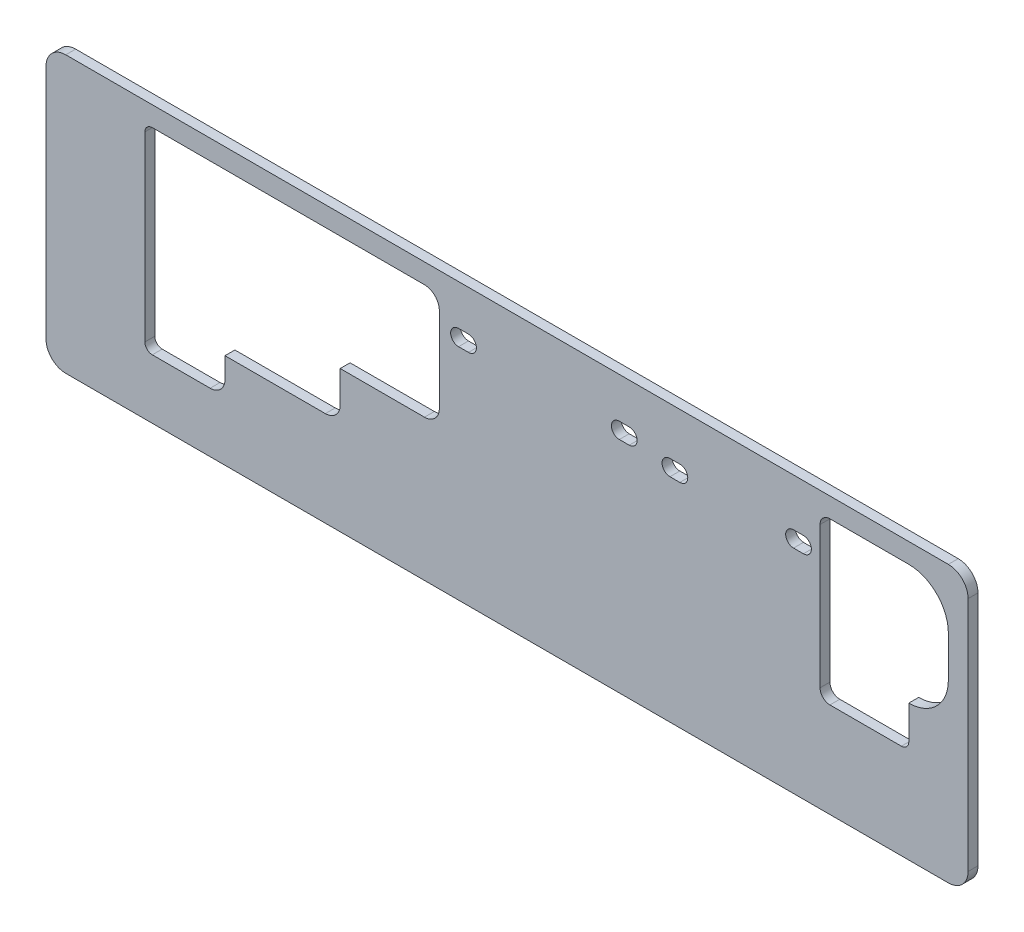
from build123d import *

# Parameters (mm, degrees)
SKETCH3_W           = 186.5
SKETCH3_H           = 55.8
SKETCH3_W_2         = 17.95
SKETCH3_H_2         = 32.6
BOSS_EXTRUDE1_DEPTH = 2
CUT_EXTRUDE2_DEPTH  = 110.736969614
CUT_EXTRUDE3_DEPTH  = 110.736969614
FILLET4_R           = 4
FILLET5_R           = 3
FILLET6_R           = 1.5
FILLET7_R           = 2


with BuildPart() as part:
    # Sketch3 → Boss-Extrude1 (new body)
    with BuildSketch(Plane.XY):
        with Locations((-4, 22.9)):
            Rectangle(SKETCH3_W, SKETCH3_H)
        Polygon((-77.25, -1), (-77.25, 38.8), (-61.05, 38.8), (-61.05, 31.6), (-37.75, 31.6), (-37.75, 22.2), (-17.7, 22.2), (-17.7, -1), align=None, mode=Mode.SUBTRACT)
        with Locations((68.275, 15.3)):
            Rectangle(SKETCH3_W_2, SKETCH3_H_2, mode=Mode.SUBTRACT)
    extrude(amount=BOSS_EXTRUDE1_DEPTH)

    # Sketch4 → Cut-Extrude2 (cut, through all)
    with BuildSketch(Plane.XY):
        with BuildLine():
            Line((-13.805, 6.4), (-11.805, 6.4))
            ThreePointArc((-11.805, 6.4), (-10.205, 4.8), (-11.805, 3.2))
            Line((-11.805, 3.2), (-13.805, 3.2))
            ThreePointArc((-13.805, 3.2), (-15.405, 4.8), (-13.805, 6.4))
        make_face()
        with BuildLine():
            Line((18.705, 6.4), (20.705, 6.4))
            ThreePointArc((20.705, 6.4), (22.305, 4.8), (20.705, 3.2))
            Line((20.705, 3.2), (18.705, 3.2))
            ThreePointArc((18.705, 3.2), (17.105, 4.8), (18.705, 6.4))
        make_face()
        with BuildLine():
            Line((28.95, 7.8), (30.95, 7.8))
            ThreePointArc((30.95, 7.8), (32.55, 6.2), (30.95, 4.6))
            Line((30.95, 4.6), (28.95, 4.6))
            ThreePointArc((28.95, 4.6), (27.35, 6.2), (28.95, 7.8))
        make_face()
        with BuildLine():
            Line((53.95, 7.8), (55.95, 7.8))
            ThreePointArc((55.95, 7.8), (57.55, 6.2), (55.95, 4.6))
            Line((55.95, 4.6), (53.95, 4.6))
            ThreePointArc((53.95, 4.6), (52.35, 6.2), (53.95, 7.8))
        make_face()
    extrude(amount=CUT_EXTRUDE2_DEPTH, mode=Mode.SUBTRACT)

    # Sketch5 → Cut-Extrude3 (cut, through all)
    with BuildSketch(Plane.XY.offset(2)):
        with BuildLine():
            Line((85.25, 15.3), (85.25, 7))
            ThreePointArc((85.25, 7), (77.25, -1), (69.25, 7))
            Line((69.25, 7), (69.25, 15.3))
            ThreePointArc((69.25, 15.3), (77.25, 23.3), (85.25, 15.3))
        make_face()
    extrude(amount=-CUT_EXTRUDE3_DEPTH, mode=Mode.SUBTRACT)

    # Fillet4
    fillet4_edges = [part.edges().sort_by_distance(p)[0] for p in [
        (-97.25, 50.8, 1),
        (89.25, 50.8, 1),
        (89.25, -5, 1),
        (-97.25, -5, 1),
    ]]
    fillet(fillet4_edges, radius=FILLET4_R)

    # Fillet5
    fillet5_edges = [part.edges().sort_by_distance(p)[0] for p in [
        (-17.7, -1, 1),
        (-17.7, 22.2, 1),
        (-37.75, 31.6, 1),
        (-61.05, 38.8, 1),
    ]]
    fillet(fillet5_edges, radius=FILLET5_R)

    # Fillet6
    fillet6_edges = [part.edges().sort_by_distance(p)[0] for p in [
        (-77.25, -1, 1),
        (-77.25, 38.8, 1),
        (77.25, 31.6, 1),
    ]]
    fillet(fillet6_edges, radius=FILLET6_R)

    # Fillet7
    fillet7_edges = [part.edges().sort_by_distance(p)[0] for p in [
        (59.3, 31.6, 1),
        (59.3, -1, 1),
    ]]
    fillet(fillet7_edges, radius=FILLET7_R)


with BuildPart() as body_2:
    # Mirror1: mirrored copy
    add(part.part.mirror(Plane.ZX))


solid = body_2.part
